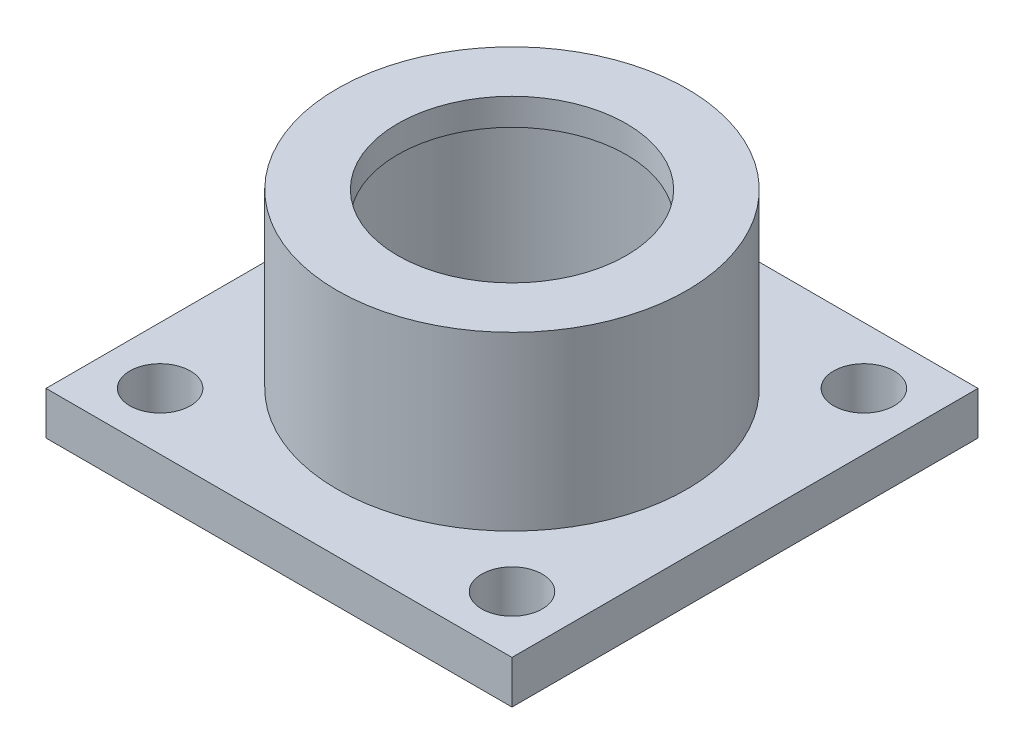
from build123d import *

# Parameters (mm, degrees)
M4_CLEARANCE_HOLE1_D = 4.5
SKETCH5_W            = 85.847558644
SKETCH5_H            = 65.066287946
SKETCH5_W_2          = 34.648232278
SKETCH5_H_2          = 34.648232278
CUT_EXTRUDE2_DEPTH   = 10


with BuildPart() as part:
    # Sketch1 → Revolve1 (revolve)
    with BuildSketch(Plane.XY):
        Polygon((-24.5, 0), (-11, 0), (-11, 14), (-8.5, 14), (-8.5, 16), (-13, 16), (-13, 3.2), (-24.5, 3.2), align=None)
    revolve(axis=Axis((0, 31.465116279, 0), (0, -1, 0)))

    # M4 Clearance Hole1 (through all)
    with Locations(Plane(origin=(0, 3.2, 0), x_dir=(1, 0, 0), z_dir=(0, 1, 0))):
        with Locations((-13.081475452, -13.081475452), (-13.081475452, 13.081475452), (13.081475452, 13.081475452), (13.081475452, -13.081475452)):
            Hole(M4_CLEARANCE_HOLE1_D / 2)

    # Sketch5 → Cut-Extrude2 (cut)
    with BuildSketch(Plane(origin=(0, 3.2, 0), x_dir=(1, 0, 0), z_dir=(0, 1, 0))):
        Rectangle(SKETCH5_W, SKETCH5_H)
        Rectangle(SKETCH5_W_2, SKETCH5_H_2, mode=Mode.SUBTRACT)
    extrude(amount=-CUT_EXTRUDE2_DEPTH, mode=Mode.SUBTRACT)


solid = part.part
